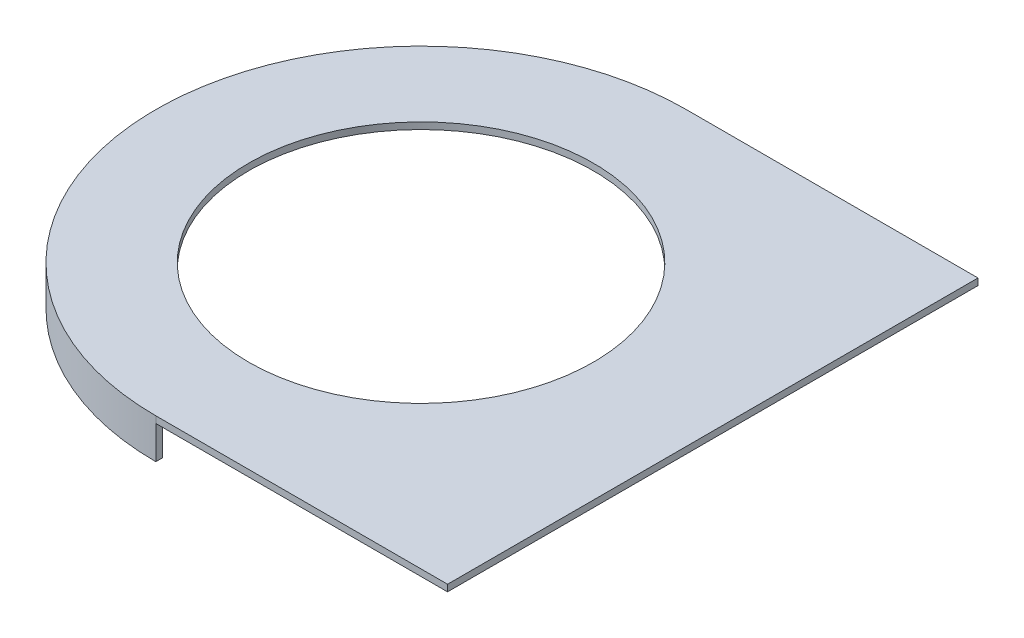
from build123d import *

# Parameters (mm, degrees)
EXTRUDE_1_DEPTH     = 0.5
EXTRUDE_START       = 2.5
EXTRUDE_2_DEPTH     = 2.5
SKETCH_3_R          = 13
CUT_EXTRUDE_1_DEPTH = 30.883105595


with BuildPart() as part:
    # 草图1 → 凸台-拉伸1 (new body)
    with BuildSketch(Plane(origin=(0, 0, 0), x_dir=(1, 0, 0), z_dir=(0, 1, 0))):
        with BuildLine():
            ThreePointArc((20, 0), (14.142135624, 14.142135624), (0, 20))
            Line((0, 20), (0, -20))
            ThreePointArc((0, -20), (14.142135624, -14.142135624), (20, 0))
        make_face()
        with BuildLine():
            Line((0, -20), (0, 20))
            ThreePointArc((0, 20), (-20, 0), (0, -20))
        make_face()
        with BuildLine():
            Line((22, 20), (0, 20))
            ThreePointArc((0, 20), (14.142135624, 14.142135624), (20, 0))
            ThreePointArc((20, 0), (14.142135624, -14.142135624), (0, -20))
            Line((0, -20), (22, -20))
            Line((22, -20), (22, 20))
        make_face()
    extrude(amount=EXTRUDE_1_DEPTH)

    # 草图2 → 凸台-拉伸2 (add)
    with BuildSketch(Plane.XZ.offset(EXTRUDE_START)):
        with BuildLine():
            Line((0, 19.5), (0, 20))
            ThreePointArc((0, 20), (-20, 0), (0, -20))
            Line((0, -20), (0, -19.5))
            ThreePointArc((0, -19.5), (-19.5, 0), (0, 19.5))
        make_face()
    extrude(amount=-EXTRUDE_2_DEPTH)

    # 草图3 → 切除-拉伸1 (cut, through all)
    with BuildSketch(Plane(origin=(0, 0.5, 0), x_dir=(1, 0, 0), z_dir=(0, 1, 0))):
        with Locations(Location((0, 0, 0), (0, 0, 270))):
            Circle(SKETCH_3_R)
    extrude(amount=-CUT_EXTRUDE_1_DEPTH, mode=Mode.SUBTRACT)


solid = part.part
